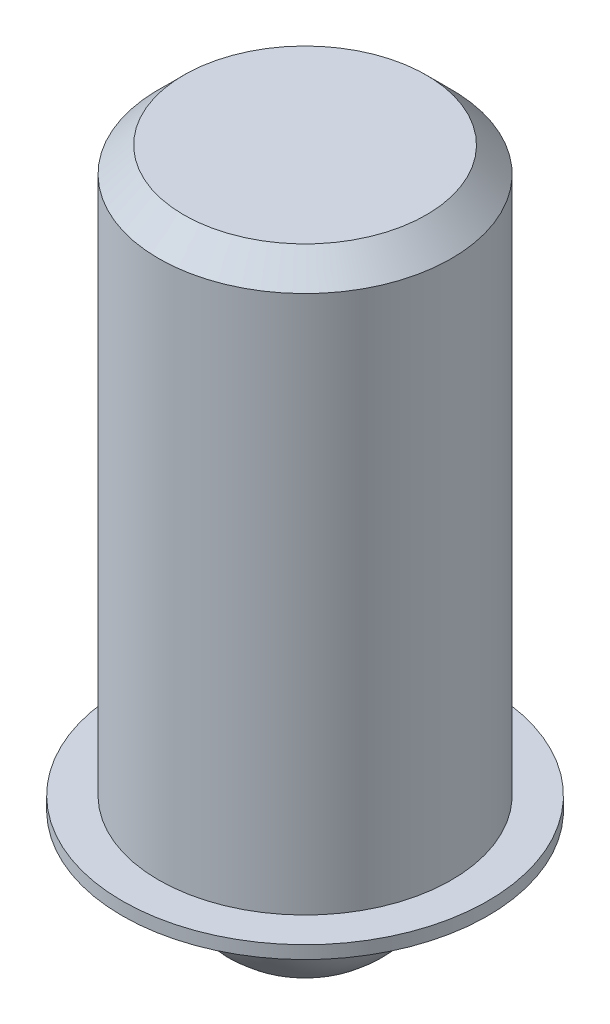
from build123d import *


with BuildPart() as part:
    # Sketch24 → Revolve2 (revolve)
    with BuildSketch(Plane(origin=(0, 0, 0), x_dir=(0, 0, -1), z_dir=(1, 0, 0))):
        Polygon((-3.9624, -4.9403), (-3.9624, -4.6609), (-3.175, -4.6609), (-3.175, 7.0104), (-2.6289, 7.5565), (0, 7.5565), (0, -4.6609), (-2.3749, -4.6609), (-2.3749, -5.7785), (-2.6289, -5.7785), align=None)
    revolve(axis=Axis((0, 7.5565, 0), (0, -1, 0)))


with BuildPart() as body_2:
    # Sketch25 → Revolve3 (revolve)
    with BuildSketch(Plane(origin=(0, 0, 0), x_dir=(0, 0, -1), z_dir=(1, 0, 0))):
        with BuildLine():
            Line((0, -7.5565), (0, -2.8067))
            ThreePointArc((0, -2.8067), (-2.3749, -5.1816), (0, -7.5565))
        make_face()
    revolve(axis=Axis((0, -4.6609, 0), (0, 1, 0)))


solid = Compound([part.part, body_2.part])
